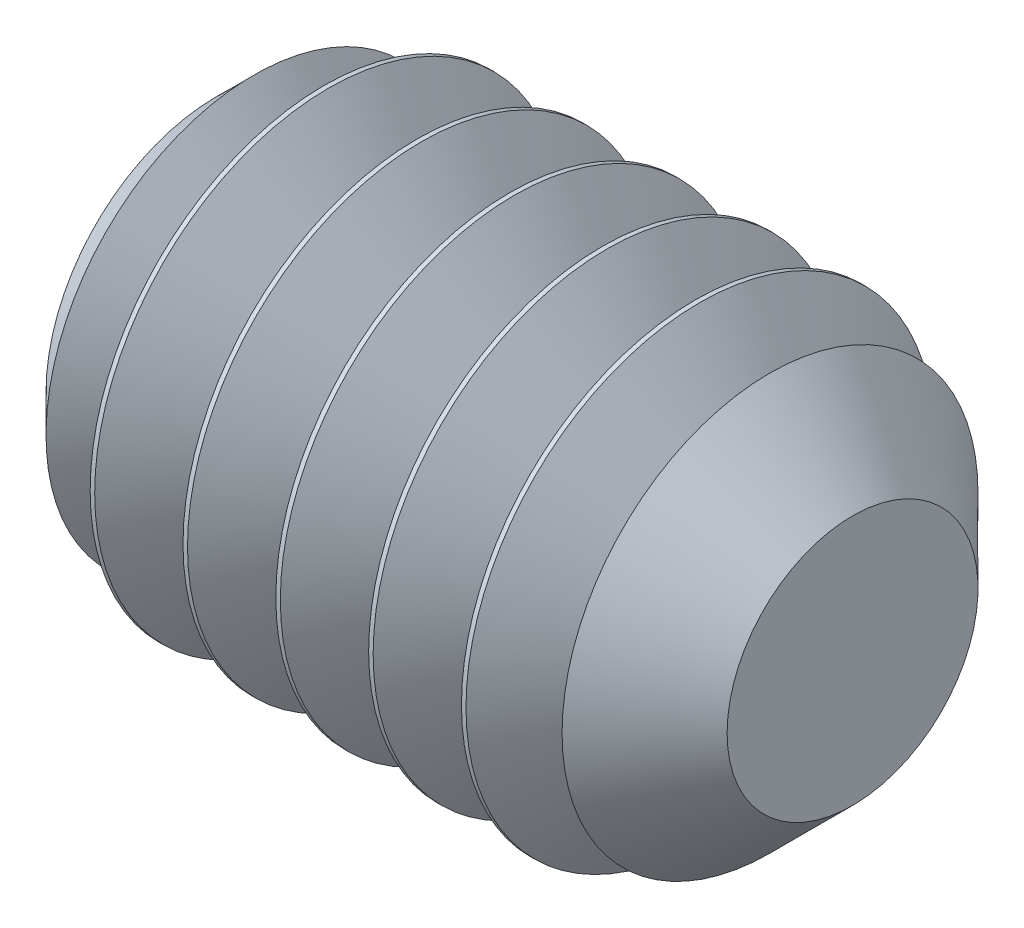
from build123d import *

# Parameters (mm, degrees)
HEX_2_DEPTH     = 2.032
THDSCHPAT_COUNT = 6
THDSCHPAT_PITCH = 0.695452015


with BuildPart() as part:
    # BodySke → BaseBody (revolve)
    with BuildSketch(Plane.XY, mode=Mode.PRIVATE) as basebody_sk:
        Polygon((0, 0), (0, 1.28016), (0.47244, 1.7526), (3.9497, 1.7526), (4.7625, 0.9398), (4.7625, 0), align=None)
    revolve(basebody_sk.sketch.rotate(Axis((-12.7, 0, 0), (1, 0, 0)), 90), axis=Axis((-12.7, 0, 0), (1, 0, 0)))

    # Sketch2 → Hex 2 (cut)
    with BuildSketch(Plane.ZY):
        Polygon((0.458271776, 0.79375), (-0.458271776, 0.79375), (-0.916543552, 0), (-0.458271776, -0.79375), (0.458271776, -0.79375), (0.916543552, 0), align=None)
    extrude(amount=-HEX_2_DEPTH, mode=Mode.SUBTRACT)

    # ThdSchSke → ThreadSchematic (revolve, cut)
    with BuildSketch(Plane.XY):
        Polygon((0.47244, -1.28016), (0.141633951, -1.7526), (0.141633951, -2.19075), (0.803246049, -2.19075), (0.803246049, -1.7526), align=None)
    threadschematic = revolve(axis=Axis((-3.175, 0, 0), (1, 0, 0)), mode=Mode.SUBTRACT)

    # ThdSchPat: ThreadSchematic ×6
    with Locations(*[(i * THDSCHPAT_PITCH, 0, 0) for i in range(1, THDSCHPAT_COUNT)]):
        add(threadschematic, mode=Mode.SUBTRACT)


solid = part.part
